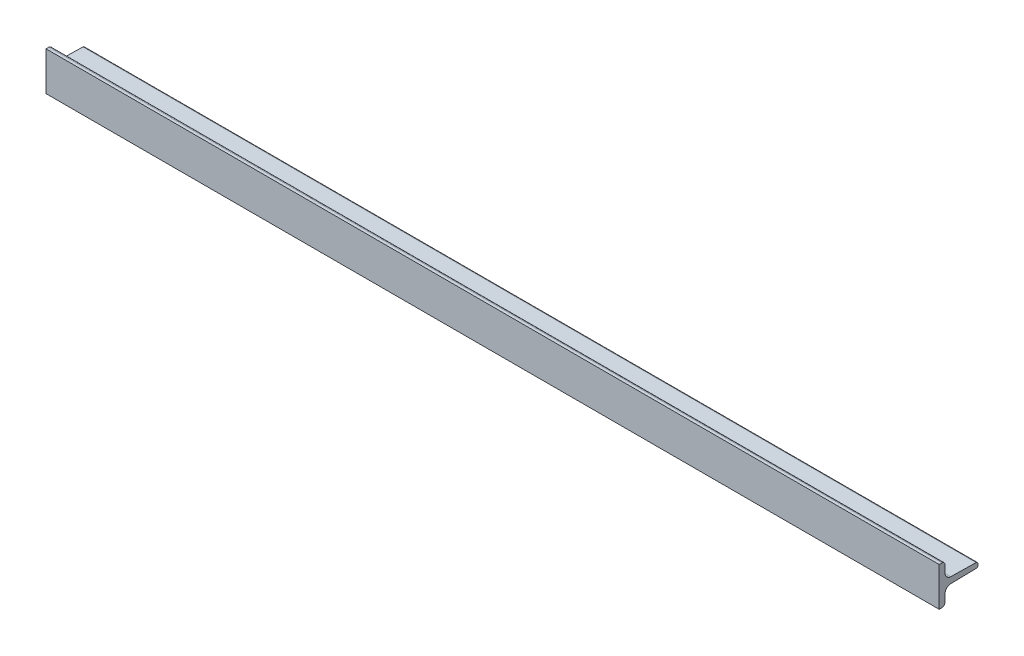
from build123d import *

# Parameters (mm, degrees)
T_SECTION_T_20_X_20_1_DEPTH = 460


with BuildPart() as part:
    # Sketch12 → T section T 20 X 20(1) (new body)
    with BuildSketch(Plane.YZ):
        with BuildLine():
            Line((-10, 20), (10, 20))
            Line((10, 20), (10, 18.570314587))
            ThreePointArc((10, 18.570314587), (9.571214338, 17.520314662), (8.530000209, 17.070614622))
            Line((8.530000209, 17.070614622), (4.520436432, 16.990406743))
            ThreePointArc((4.520436432, 16.990406743), (2.459116507, 16.112327155), (1.581036919, 14.05100723))
            Line((1.581036919, 14.05100723), (1.319562646, 0.97999986))
            ThreePointArc((1.319562646, 0.97999986), (1.019762619, 0.285857108), (0.319762669, 0))
            Line((0.319762669, 0), (-0.319762669, 0))
            ThreePointArc((-0.319762669, 0), (-1.019762619, 0.285857108), (-1.319562646, 0.97999986))
            Line((-1.319562646, 0.97999986), (-1.581036919, 14.05100723))
            ThreePointArc((-1.581036919, 14.05100723), (-2.459116507, 16.112327155), (-4.520436432, 16.990406743))
            Line((-4.520436432, 16.990406743), (-8.530000209, 17.070614622))
            ThreePointArc((-8.530000209, 17.070614622), (-9.571214338, 17.520314662), (-10, 18.570314587))
            Line((-10, 18.570314587), (-10, 20))
        make_face()
    extrude(amount=T_SECTION_T_20_X_20_1_DEPTH)


solid = part.part
